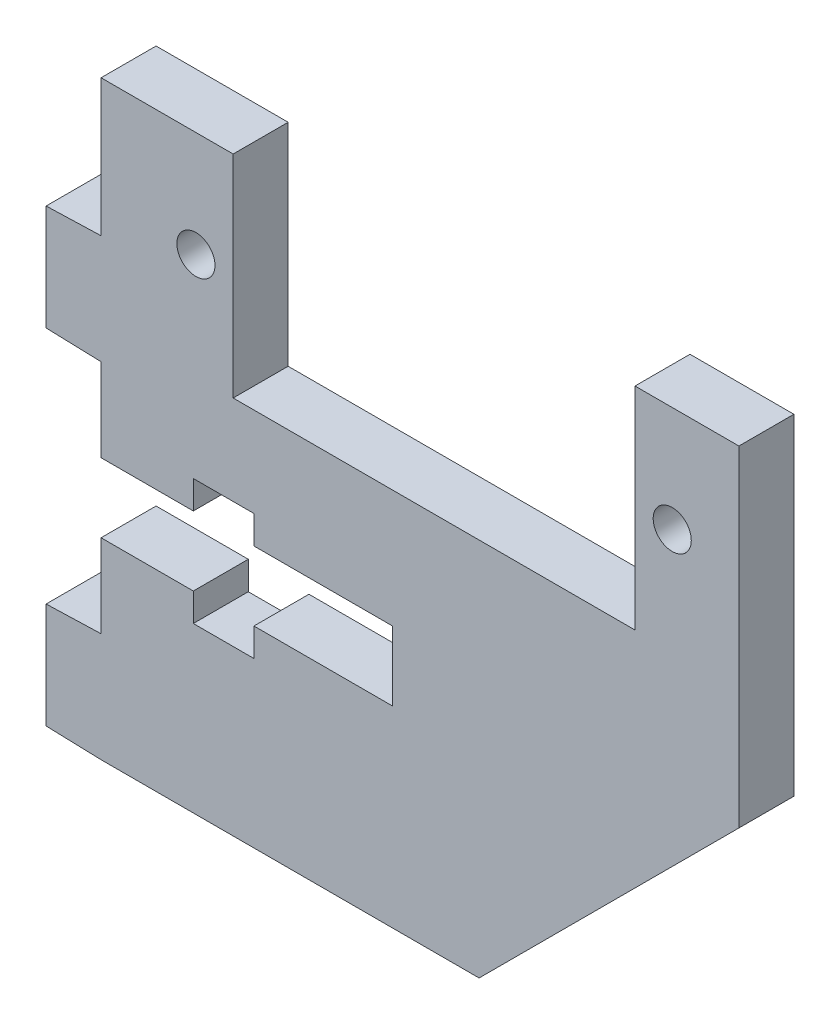
from build123d import *

# Parameters (mm, degrees)
SKETCH1_R           = 1.1
BOSS_EXTRUDE1_DEPTH = 3.175
CHAMFER1_SIZE       = 15


with BuildPart() as part:
    # Sketch1 → Boss-Extrude1 (new body)
    # profile 1 of 6: a face of its own
    with BuildSketch(Plane.XY):
        Polygon((10.8, 21.8), (10.8, 34), (3.175, 34), (3.175, 26.1), (3.175, 26), (0, 26), (0, 19.9), (3.175, 19.9), (3.175, 19.8), (3.175, 17), (40, 17), (40, 34), (34, 34), (34, 21.8), align=None)
        with Locations((8.65, 27.9)):
            Circle(SKETCH1_R, mode=Mode.SUBTRACT)
        with Locations((36.15, 27.9)):
            Circle(SKETCH1_R, mode=Mode.SUBTRACT)
    # profile 2 of 6: a face of its own
    with BuildSketch(Plane.XY):
        Polygon((40, 0), (40, 17), (3.175, 17), (3.175, 15), (8.5, 15), (8.5, 16.625), (12, 16.625), (12, 15), (20, 15), (20, 11), (12, 11), (12, 9.375), (8.5, 9.375), (8.5, 11), (3.175, 11), (3.175, 6.2), (3.175, 6.1), (0, 6.1), (0, 0), align=None)
    # profile 3 of 6: a face of its own
    with BuildSketch(Plane.XY):
        Polygon((3.175, 26), (3.175, 26.1), (0, 26), align=None)
    # profile 4 of 6: a face of its own
    with BuildSketch(Plane.XY):
        Polygon((3.175, 19.9), (0, 19.9), (3.175, 19.8), align=None)
    # profile 5 of 6: a face of its own
    with BuildSketch(Plane.XY):
        Polygon((3.175, 6.2), (0, 6.1), (3.175, 6.1), align=None)
    # profile 6 of 6: a face of its own
    with BuildSketch(Plane.XY):
        Polygon((40, -0.1), (40, 0), (0, 0), (3.175, -0.1), align=None)
    extrude(amount=BOSS_EXTRUDE1_DEPTH)

    # Chamfer1
    chamfer1_edges = [part.edges().sort_by_distance(p)[0] for p in [
        (40, -0.1, 1.5875),
    ]]
    chamfer(chamfer1_edges, length=CHAMFER1_SIZE)


solid = part.part
